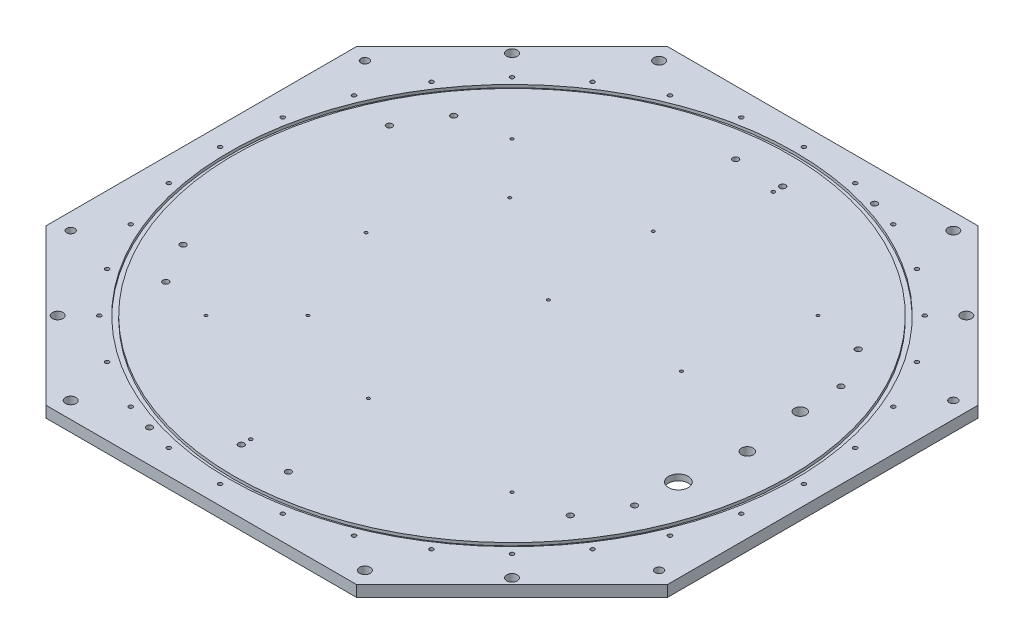
from build123d import *

# Parameters (mm, degrees)
BASE_PLATE_PROFILE_DEPTH                     = 4.7625
M3_CLEARANCE_HOLE_FOR_CYLINDER_D             = 3.4
M6X1_TAPPED_HOLE_FOR_SUPPORT_PILLARS_D       = 5
M6X1_TAPPED_HOLE_FOR_SUPPORT_PILLARS_DEPTH   = 6
M6X1_TAPPED_HOLE_FOR_SUPPORT_PILLARS_TIP     = 1.502151548
F_3_0MM_DOWEL_HOLE_FOR_SUPPORT_PILLARS_D     = 3
F_3_0MM_DOWEL_HOLE_FOR_SUPPORT_PILLARS_DEPTH = 6
F_3_0MM_DOWEL_HOLE_FOR_SUPPORT_PILLARS_TIP   = 0.901290929
M3X0_5_TAPPED_HOLE_FOR_PCB_STANDOFFS_D       = 2.5
M3X0_5_TAPPED_HOLE_FOR_PCB_STANDOFFS_DEPTH   = 6.5
M3X0_5_TAPPED_HOLE_FOR_PCB_STANDOFFS_TIP     = 0.751075774
M8_CLEARANCE_HOLE_FOR_LIFTING_ALIGNM_D       = 9
M8X1_25_TAPPED_HOLE_FOR_SUPER_STRUCTURE_D    = 6.8
F_7_16_20_TAPPED_HOLE_FOR_PENETRATOR_D       = 9.92124
SKETCH28_R                                   = 240.5
SKETCH28_R_2                                 = 236.3344
O_RING_GROOVE_DEPTH                          = 2.413
CIRPATTERN_EXTRACABLES_COUNT                 = 2
CIRPATTERN_EXTRACABLES_ANGLE                 = 15
F_5_8_CLEARANCE_HOLE1_D                      = 16.66748
SKETCH35_R                                   = 18
CUT_EXTRUDE1_DEPTH                           = 4.5
M8_CLEARANCE_HOLE_D                          = 9
F_5_0MM_DOWEL_HOLE1_D                        = 5.05
F_5_0MM_DOWEL_HOLE1_DEPTH                    = 5
F_5_0MM_DOWEL_HOLE1_TIP                      = 1.517173063


with BuildPart() as part:
    # Sketch1 → Base Plate Profile (new, symmetric)
    with BuildSketch(Plane(origin=(0, 0, 0), x_dir=(1, 0, 0), z_dir=(0, 1, 0))):
        Polygon((-131.979797464, 264), (131.979797464, 264), (264, 131.979797464), (264, -131.979797464), (131.979797464, -264), (-131.979797464, -264), (-264, -131.979797464), (-264, 131.979797464), align=None)
    extrude(amount=BASE_PLATE_PROFILE_DEPTH, both=True)

    # M3 Clearance Hole - For Cylinder (through all)
    with Locations(Plane(origin=(0, 4.7625, 0), x_dir=(1, 0, 0), z_dir=(0, 1, 0))):
        with Locations((248, 0), (243.23474954, -48.38239986), (229.122124063, -94.905491227), (206.204463851, -137.781417789), (175.362481734, -175.362481734), (137.781417789, -206.204463851), (94.905491227, -229.122124063), (48.38239986, -243.23474954), (0, -248), (-48.38239986, -243.23474954), (-94.905491227, -229.122124063), (-137.781417789, -206.204463851), (-175.362481734, -175.362481734), (-206.204463851, -137.781417789), (-229.122124063, -94.905491227), (-243.23474954, -48.38239986), (-248, 0), (-243.23474954, 48.38239986), (-229.122124063, 94.905491227), (-206.204463851, 137.781417789), (-175.362481734, 175.362481734), (-137.781417789, 206.204463851), (-94.905491227, 229.122124063), (-48.38239986, 243.23474954), (0, 248), (48.38239986, 243.23474954), (94.905491227, 229.122124063), (137.781417789, 206.204463851), (175.362481734, 175.362481734), (206.204463851, 137.781417789), (229.122124063, 94.905491227), (243.23474954, 48.38239986)):
            Hole(M3_CLEARANCE_HOLE_FOR_CYLINDER_D / 2)

    # M6x1 Tapped Hole - For Support Pillars
    with Locations(Plane(origin=(0, 4.7625, 0), x_dir=(1, 0, 0), z_dir=(0, 1, 0))):
        with Locations((-20, 210), (20, 210), (171.865334795, 122.320508076), (191.865334795, 87.679491924), (191.865334795, -87.679491924), (171.865334795, -122.320508076), (20, -210), (-20, -210), (-171.865334795, -122.320508076), (-191.865334795, -87.679491924), (-191.865334795, 87.679491924), (-171.865334795, 122.320508076)):
            Hole(M6X1_TAPPED_HOLE_FOR_SUPPORT_PILLARS_D / 2, depth=M6X1_TAPPED_HOLE_FOR_SUPPORT_PILLARS_DEPTH)
            with Locations((0, 0, -(M6X1_TAPPED_HOLE_FOR_SUPPORT_PILLARS_DEPTH + M6X1_TAPPED_HOLE_FOR_SUPPORT_PILLARS_TIP / 2))):  # 118° drill point
                Cone(0, M6X1_TAPPED_HOLE_FOR_SUPPORT_PILLARS_D / 2, M6X1_TAPPED_HOLE_FOR_SUPPORT_PILLARS_TIP, mode=Mode.SUBTRACT)

    # Ø3.0mm Dowel Hole - For Support Pillars
    with Locations(Plane(origin=(0, 4.7625, 0), x_dir=(1, 0, 0), z_dir=(0, 1, 0))):
        with Locations((20, 202), (-20, -202)):
            Hole(F_3_0MM_DOWEL_HOLE_FOR_SUPPORT_PILLARS_D / 2, depth=F_3_0MM_DOWEL_HOLE_FOR_SUPPORT_PILLARS_DEPTH)
            with Locations((0, 0, -(F_3_0MM_DOWEL_HOLE_FOR_SUPPORT_PILLARS_DEPTH + F_3_0MM_DOWEL_HOLE_FOR_SUPPORT_PILLARS_TIP / 2))):  # 118° drill point
                Cone(0, F_3_0MM_DOWEL_HOLE_FOR_SUPPORT_PILLARS_D / 2, F_3_0MM_DOWEL_HOLE_FOR_SUPPORT_PILLARS_TIP, mode=Mode.SUBTRACT)

    # M3x0.5 Tapped Hole - For PCB Standoffs
    with Locations(Plane(origin=(0, 4.7625, 0), x_dir=(1, 0, 0), z_dir=(0, 1, 0))):
        with Locations((113, 31), (-130, -130), (130, -130), (130, 130), (-130, 130), (-86.8, -86.7), (0, -122), (-123, -1), (-87.7, 85.8), (4, 27), (-2, 122)):
            Hole(M3X0_5_TAPPED_HOLE_FOR_PCB_STANDOFFS_D / 2, depth=M3X0_5_TAPPED_HOLE_FOR_PCB_STANDOFFS_DEPTH)
            with Locations((0, 0, -(M3X0_5_TAPPED_HOLE_FOR_PCB_STANDOFFS_DEPTH + M3X0_5_TAPPED_HOLE_FOR_PCB_STANDOFFS_TIP / 2))):  # 118° drill point
                Cone(0, M3X0_5_TAPPED_HOLE_FOR_PCB_STANDOFFS_D / 2, M3X0_5_TAPPED_HOLE_FOR_PCB_STANDOFFS_TIP, mode=Mode.SUBTRACT)

    # M8 Clearance Hole - For Lifting / Alignment (through all)
    with Locations(Plane(origin=(0, 4.7625, 0), x_dir=(1, 0, 0), z_dir=(0, 1, 0))):
        with Locations((-193.040151264, -193.040151264), (-193.040151264, 193.040151264), (193.040151264, 193.040151264), (193.040151264, -193.040151264)):
            Hole(M8_CLEARANCE_HOLE_FOR_LIFTING_ALIGNM_D / 2)

    # M8x1.25 Tapped Hole -For Super Structure (through all)
    with Locations(Plane(origin=(0, 4.7625, 0), x_dir=(1, 0, 0), z_dir=(0, 1, 0))):
        with Locations((250, 125), (-250, -125), (-250, 125), (250, -125)):
            Hole(M8X1_25_TAPPED_HOLE_FOR_SUPER_STRUCTURE_D / 2)

    # 7/16-20 Tapped Hole - For Penetrator (through all)
    with Locations(Plane(origin=(0, -4.7625, 0), x_dir=(-1, 0, 0), z_dir=(0, -1, 0))):
        with Locations((-200, 0)):
            f_7_16_20_tapped_hole_for_penetrator = Hole(F_7_16_20_TAPPED_HOLE_FOR_PENETRATOR_D / 2)

    # Sketch28 → O-ring Groove (cut)
    with BuildSketch(Plane(origin=(0, 4.7625, 0), x_dir=(1, 0, 0), z_dir=(0, 1, 0))):
        with Locations(Location((0, 0, 0), (0, 0, 270))):
            Circle(SKETCH28_R)
        with Locations(Location((0, 0, 0), (0, 0, 270))):
            Circle(SKETCH28_R_2, mode=Mode.SUBTRACT)
    extrude(amount=-O_RING_GROOVE_DEPTH, mode=Mode.SUBTRACT)

    # CirPattern_extraCables: 7/16-20 Tapped Hole - For Penetrator ×2 about axis
    cirpattern_extracables_axis = Axis((0, -5.23875, 0), (0, 1, 0))
    for i in range(1, CIRPATTERN_EXTRACABLES_COUNT):
        add(f_7_16_20_tapped_hole_for_penetrator.rotate(cirpattern_extracables_axis, i * CIRPATTERN_EXTRACABLES_ANGLE / (CIRPATTERN_EXTRACABLES_COUNT - 1)), mode=Mode.SUBTRACT)

    # 5/8 Clearance Hole1 (through all)
    with Locations(Plane(origin=(0, 4.7625, 0), x_dir=(1, 0, 0), z_dir=(0, 1, 0))):
        with Locations((193.185165258, -51.763809021)):
            Hole(F_5_8_CLEARANCE_HOLE1_D / 2)

    # Sketch35 → Cut-Extrude1 (cut)
    with BuildSketch(Plane.XZ.offset(4.7625)):
        with Locations(Location((193.185165258, 51.763809021, 0), (0, 0, 270))):
            Circle(SKETCH35_R)
    extrude(amount=-CUT_EXTRUDE1_DEPTH, mode=Mode.SUBTRACT)

    # M8 Clearance Hole (through all)
    with Locations(Plane(origin=(-28.123925909, 4.7625, -48.06749493), x_dir=(1, 0, 0), z_dir=(0, 1, 0))):
        with Locations((-96.876074091, -298.06749493), (-96.876074091, 201.93250507), (153.123925909, -298.06749493), (153.123925909, 201.93250507)):
            Hole(M8_CLEARANCE_HOLE_D / 2)

    # Ø5.0mm Dowel Hole1
    with Locations(Plane(origin=(0, 4.7625, 0), x_dir=(1, 0, 0), z_dir=(0, 1, 0))):
        with Locations((71.700315282, 236.364262926), (-71.700315282, -236.364262926)):
            Hole(F_5_0MM_DOWEL_HOLE1_D / 2, depth=F_5_0MM_DOWEL_HOLE1_DEPTH)
            with Locations((0, 0, -(F_5_0MM_DOWEL_HOLE1_DEPTH + F_5_0MM_DOWEL_HOLE1_TIP / 2))):  # 118° drill point
                Cone(0, F_5_0MM_DOWEL_HOLE1_D / 2, F_5_0MM_DOWEL_HOLE1_TIP, mode=Mode.SUBTRACT)


solid = part.part
